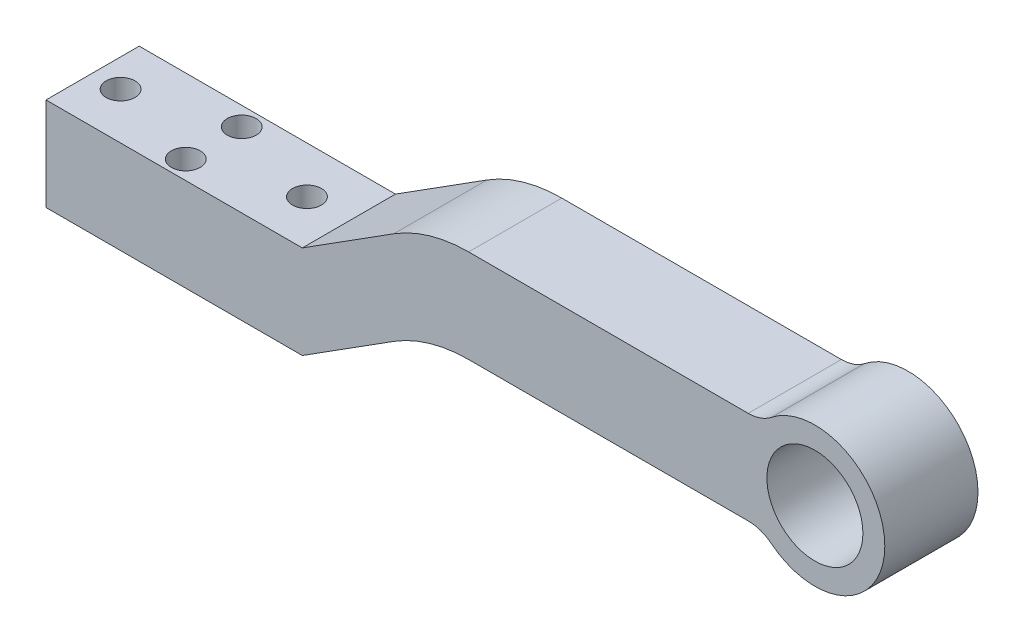
from build123d import *

# Parameters (mm, degrees)
MODEL_R             = 10.3
EXTRUDE_1_DEPTH     = 20
SKETCH_2_R          = 1.6
CUT_EXTRUDE_1_DEPTH = 22
SKETCH_4_R          = 3.1
CUT_EXTRUDE_2_DEPTH = 9
SKETCH_5_W          = 3
SKETCH_5_H          = 20
CUT_EXTRUDE_3_DEPTH = 22


with BuildPart() as part:
    # Model → 凸台-拉伸1 (new body)
    with BuildSketch(Plane.XY):
        with BuildLine():
            Line((233.591051214, 295.2839002), (226.237796851, 290.623912247))
            Line((226.237796851, 290.623912247), (217.532290693, 290.623912247))
            Line((217.532290693, 290.623912247), (168.237796851, 290.623912247))
            Line((168.237796851, 290.623912247), (168.237796851, 270.623912247))
            Line((168.237796851, 270.623912247), (226.237796851, 270.623912247))
            Line((226.237796851, 270.623912247), (245.869173527, 283.06493146))
            ThreePointArc((245.869173527, 283.06493146), (253.567322868, 286.536378604), (261.927934048, 287.724919413))
            Line((261.927934048, 287.724919413), (321.918709695, 287.724919413))
            ThreePointArc((321.918709695, 287.724919413), (324.556497218, 287.277539951), (326.899261749, 285.985438659))
            ThreePointArc((326.899261749, 285.985438659), (351.237796839, 297.723317855), (326.900192078, 309.463125896))
            ThreePointArc((326.900192078, 309.463125896), (324.557590785, 308.171303033), (321.920064905, 307.724039843))
            Line((321.920064905, 307.724039843), (261.928239839, 307.724854901))
            ThreePointArc((261.928239839, 307.724854901), (253.567416793, 306.536370888), (245.869071734, 303.06486695))
            Line((245.869071734, 303.06486695), (233.591051214, 295.2839002))
        make_face()
        with Locations((336.237796851, 297.723912247)):
            Circle(MODEL_R, mode=Mode.SUBTRACT)
    extrude(amount=EXTRUDE_1_DEPTH)

    # 草图2 → 切除-拉伸1 (cut)
    with BuildSketch(Plane(origin=(0, 270.623912247, 0), x_dir=(-1, 0, 0), z_dir=(0, -1, 0))):
        with Locations(Location((-177.237796851, -10, 0), (0, 0, 90))):
            Circle(SKETCH_2_R)
        with Locations(Location((-217.237796851, -10, 0), (0, 0, 90))):
            Circle(SKETCH_2_R)
        with Locations(Location((-197.237796851, -16, 0), (0, 0, 90))):
            Circle(SKETCH_2_R)
        with Locations(Location((-197.237796851, -4, 0), (0, 0, 90))):
            Circle(SKETCH_2_R)
    extrude(amount=-CUT_EXTRUDE_1_DEPTH, mode=Mode.SUBTRACT)

    # 草图4 → 切除-拉伸2 (cut)
    with BuildSketch(Plane(origin=(0, 290.623912247, 0), x_dir=(1, 0, 0), z_dir=(0, 1, 0))):
        with Locations(Location((177.237796851, -10, 0), (0, 0, 270))):
            Circle(SKETCH_4_R)
        with Locations(Location((197.237796851, -16, 0), (0, 0, 270))):
            Circle(SKETCH_4_R)
        with Locations(Location((197.237796851, -4, 0), (0, 0, 270))):
            Circle(SKETCH_4_R)
        with Locations(Location((217.237796851, -10, 0), (0, 0, 270))):
            Circle(SKETCH_4_R)
    extrude(amount=-CUT_EXTRUDE_2_DEPTH, mode=Mode.SUBTRACT)

    # 草图5 → 切除-拉伸3 (cut)
    with BuildSketch(Plane(origin=(0, 290.623912247, 0), x_dir=(1, 0, 0), z_dir=(0, 1, 0))):
        with Locations((169.737796851, -10)):
            Rectangle(SKETCH_5_W, SKETCH_5_H)
    extrude(amount=-CUT_EXTRUDE_3_DEPTH, mode=Mode.SUBTRACT)


solid = part.part
